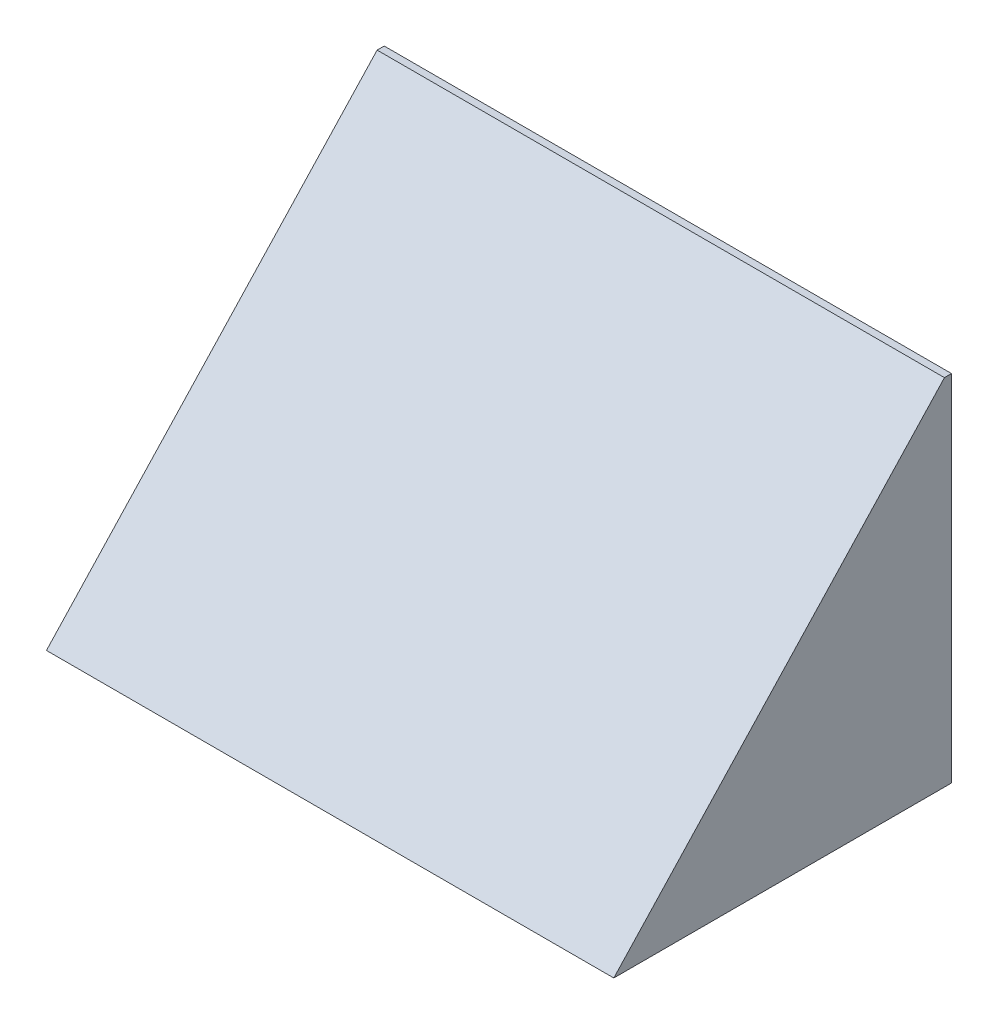
from build123d import *

# Parameters (mm, degrees)
SKETCH_2_W      = 80
SKETCH_2_H      = 50
EXTRUDE_2_DEPTH = 1
DRAFT_6_ANGLE   = 43


with BuildPart() as part:
    # 草图2 → 凸台-拉伸2 (new body)
    with BuildSketch(Plane.XY):
        Rectangle(SKETCH_2_W, SKETCH_2_H)
    extrude(amount=EXTRUDE_2_DEPTH)

    # 拔模6
    draft_6_faces = [part.faces().sort_by_distance(p)[0] for p in [
        (0, 0, 1),
    ]]
    draft(draft_6_faces, Plane(origin=(-40, 25, 1), x_dir=(0, 0, 1), z_dir=(0, 1, 0)), DRAFT_6_ANGLE)


solid = part.part
